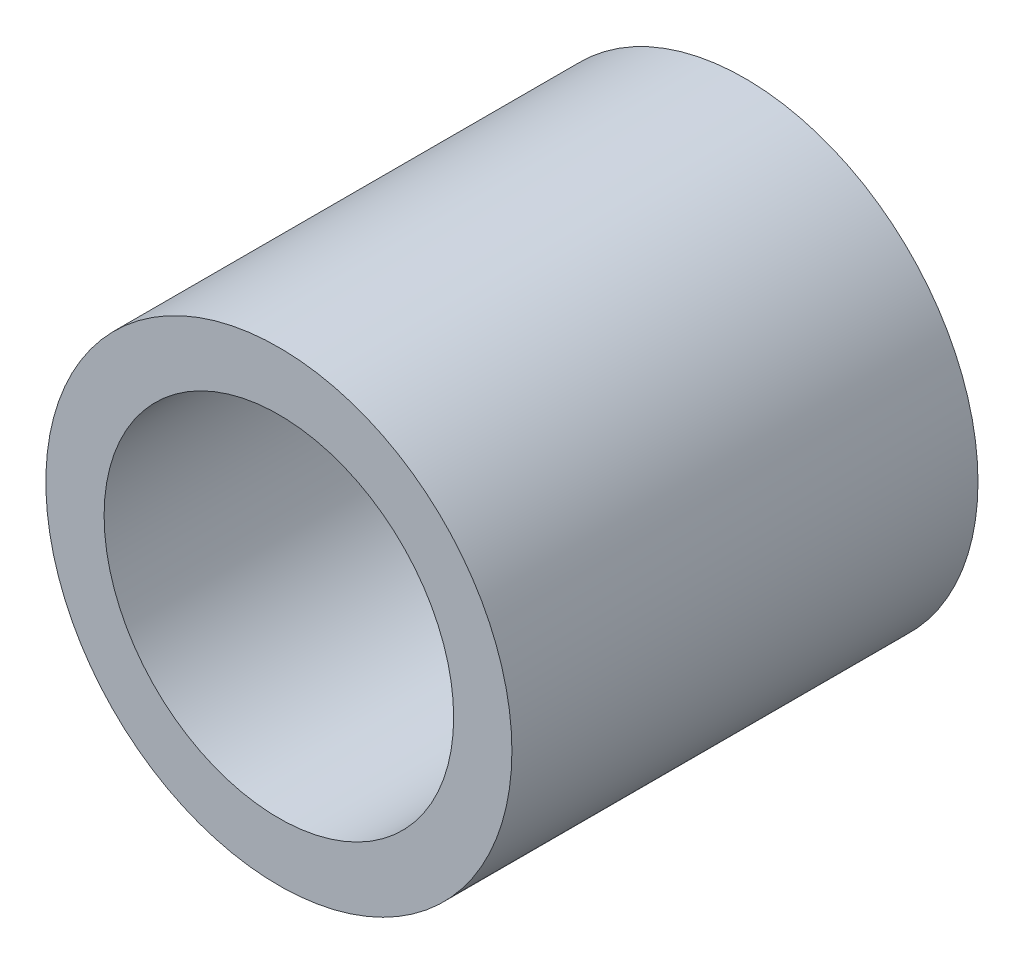
from build123d import *

# Parameters (mm, degrees)
SKETCH2_R           = 6.35
SKETCH2_R_2         = 4.7625
BOSS_EXTRUDE1_DEPTH = 12.7


with BuildPart() as part:
    # Sketch2 → Boss-Extrude1 (new body)
    with BuildSketch(Plane.XY):
        Circle(SKETCH2_R)
        Circle(SKETCH2_R_2, mode=Mode.SUBTRACT)
    extrude(amount=BOSS_EXTRUDE1_DEPTH)


solid = part.part
